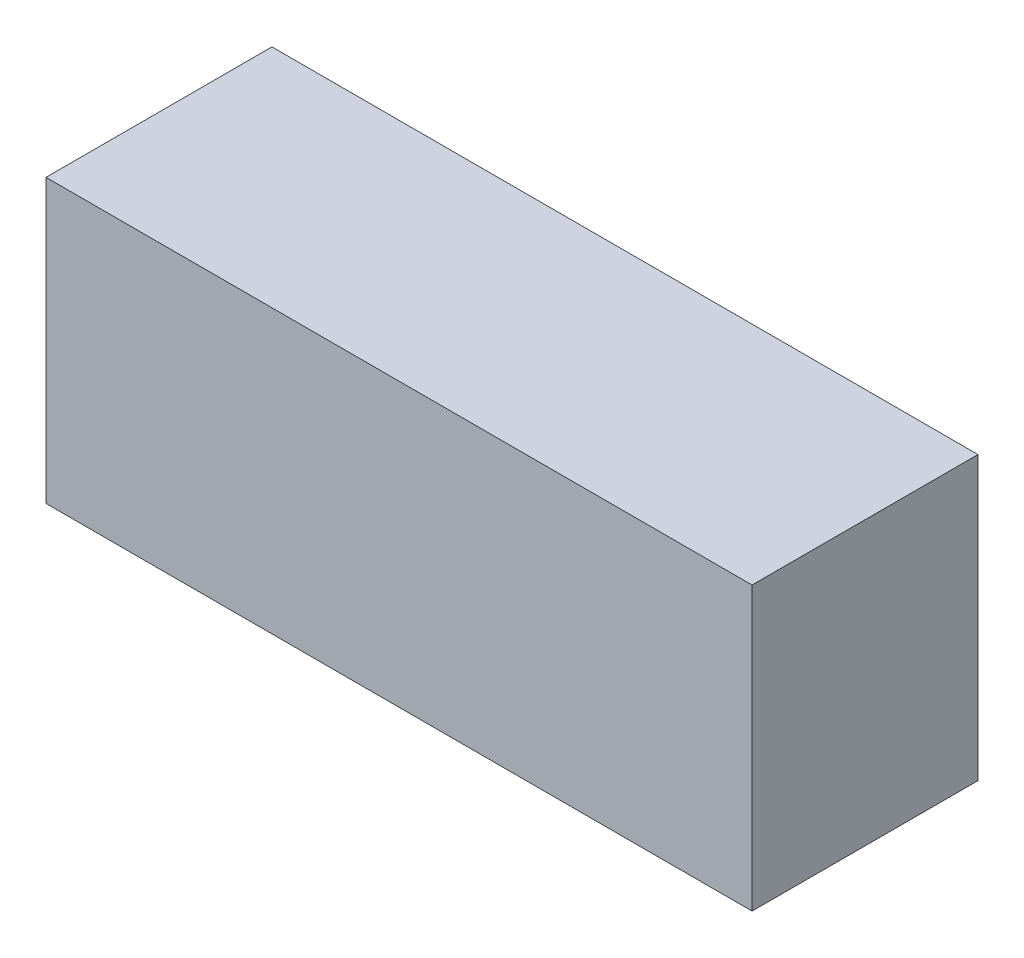
from build123d import *

# Parameters (mm, degrees)
SKETCH_1_W      = 625
SKETCH_1_H      = 200
EXTRUDE_1_DEPTH = 250


with BuildPart() as part:
    # Эскиз1 → Бобышка-Вытянуть1 (new body)
    with BuildSketch(Plane(origin=(0, 0, 0), x_dir=(1, 0, 0), z_dir=(0, 1, 0))):
        with Locations((312.5, 100)):
            Rectangle(SKETCH_1_W, SKETCH_1_H)
    extrude(amount=EXTRUDE_1_DEPTH)


solid = part.part
